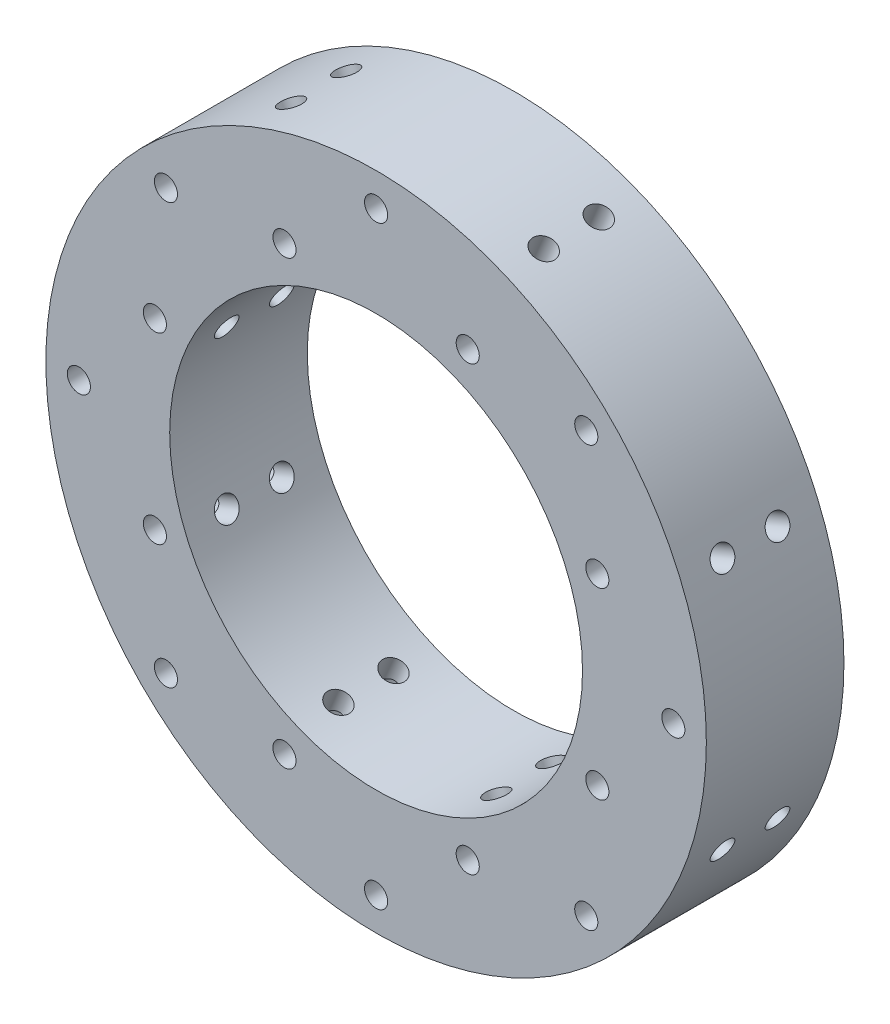
from build123d import *

# Parameters (mm, degrees)
SKETCH2_R           = 60
SKETCH2_R_2         = 37.5
SKETCH2_R_3         = 2.1
BOSS_EXTRUDE1_DEPTH = 25
SKETCH4_R           = 2.1
CUT_EXTRUDE1_DEPTH  = 89.459030065
CIRPATTERN1_COUNT   = 4
CIRPATTERN1_ANGLE   = 135


with BuildPart() as part:
    # Sketch2 → Boss-Extrude1 (new body)
    with BuildSketch(Plane.XY):
        Circle(SKETCH2_R)
        Circle(SKETCH2_R_2, mode=Mode.SUBTRACT)
        with Locations((0, 54)):
            Circle(SKETCH2_R_3, mode=Mode.SUBTRACT)
        with Locations((38.183766184, 38.183766184)):
            Circle(SKETCH2_R_3, mode=Mode.SUBTRACT)
        with Locations((54, 0)):
            Circle(SKETCH2_R_3, mode=Mode.SUBTRACT)
        with Locations((38.183766184, -38.183766184)):
            Circle(SKETCH2_R_3, mode=Mode.SUBTRACT)
        with Locations((0, -54)):
            Circle(SKETCH2_R_3, mode=Mode.SUBTRACT)
        with Locations((-38.183766184, -38.183766184)):
            Circle(SKETCH2_R_3, mode=Mode.SUBTRACT)
        with Locations((-54, 0)):
            Circle(SKETCH2_R_3, mode=Mode.SUBTRACT)
        with Locations((-38.183766184, 38.183766184)):
            Circle(SKETCH2_R_3, mode=Mode.SUBTRACT)
        with Locations((16.646729308, 40.188759664)):
            Circle(SKETCH2_R_3, mode=Mode.SUBTRACT)
        with Locations((40.188759664, 16.646729308)):
            Circle(SKETCH2_R_3, mode=Mode.SUBTRACT)
        with Locations((40.188759664, -16.646729308)):
            Circle(SKETCH2_R_3, mode=Mode.SUBTRACT)
        with Locations((16.646729308, -40.188759664)):
            Circle(SKETCH2_R_3, mode=Mode.SUBTRACT)
        with Locations((-16.646729308, -40.188759664)):
            Circle(SKETCH2_R_3, mode=Mode.SUBTRACT)
        with Locations((-40.188759664, -16.646729308)):
            Circle(SKETCH2_R_3, mode=Mode.SUBTRACT)
        with Locations((-40.188759664, 16.646729308)):
            Circle(SKETCH2_R_3, mode=Mode.SUBTRACT)
        with Locations((-16.646729308, 40.188759664)):
            Circle(SKETCH2_R_3, mode=Mode.SUBTRACT)
    extrude(amount=BOSS_EXTRUDE1_DEPTH)

    # Sketch4 → Cut-Extrude1 (cut, symmetric)
    with BuildSketch(Plane(origin=(0, 0, 0), x_dir=(0, 0, -1), z_dir=(-0.3826834323650906, 0.9238795325112865, 0))):
        with Locations(Location((-7.5, 0, 0), (0, 0, 90))):
            Circle(SKETCH4_R)
        with Locations(Location((-17.5, 0, 0), (0, 0, 90))):
            Circle(SKETCH4_R)
    cut_extrude1 = extrude(amount=CUT_EXTRUDE1_DEPTH, both=True, mode=Mode.SUBTRACT)

    # CirPattern1: Cut-Extrude1 ×4 about axis
    cirpattern1_axis = Axis((0, 0, 25), (0, 0, 1))
    for i in range(1, CIRPATTERN1_COUNT):
        add(cut_extrude1.rotate(cirpattern1_axis, i * CIRPATTERN1_ANGLE / (CIRPATTERN1_COUNT - 1)), mode=Mode.SUBTRACT)


solid = part.part
